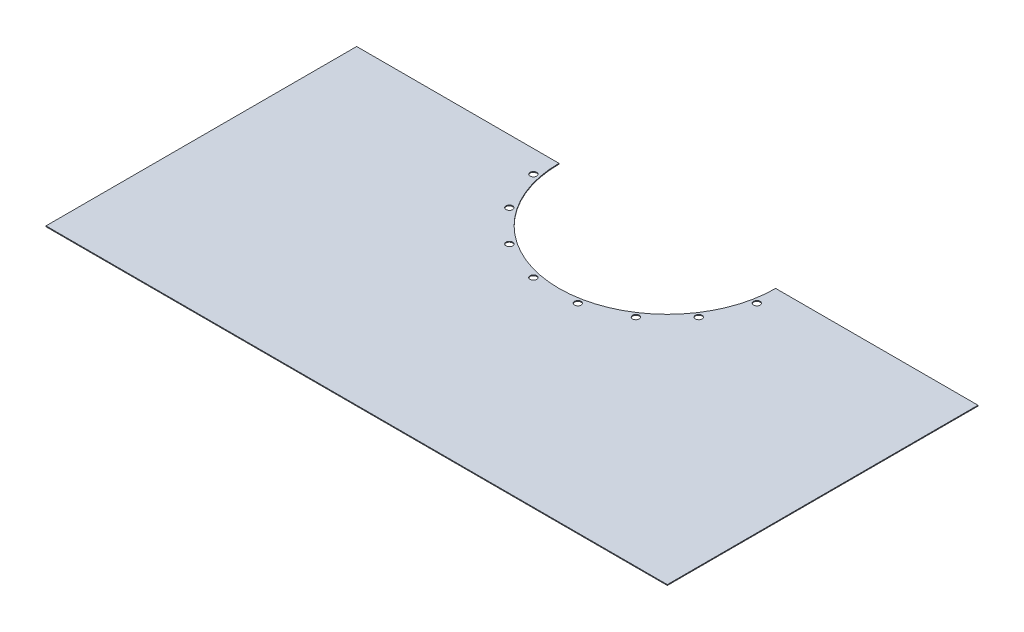
from build123d import *

# Parameters (mm, degrees)
SKETCH2_R           = 6.5
BOSS_EXTRUDE2_DEPTH = 1.5875


with BuildPart() as part:
    # Sketch2 → Boss-Extrude2 (new body)
    with BuildSketch(Plane(origin=(0, 0, 0), x_dir=(1, 0, 0), z_dir=(0, 1, 0))):
        with BuildLine():
            ThreePointArc((-212.625, 0), (0, -212.625), (212.625, 0))
            Line((212.625, 0), (609.6, 0))
            Line((609.6, 0), (609.6, -609.6))
            Line((609.6, -609.6), (-609.6, -609.6))
            Line((-609.6, -609.6), (-609.6, 0))
            Line((-609.6, 0), (-212.625, 0))
        make_face()
        with Locations(Location((-219.20551017, -43.602686971, 0), (0, 0, 270))):
            Circle(SKETCH2_R, mode=Mode.SUBTRACT)
        with Locations(Location((-185.83345835, -124.16994708, 0), (0, 0, 270))):
            Circle(SKETCH2_R, mode=Mode.SUBTRACT)
        with Locations(Location((-124.16994708, -185.83345835, 0), (0, 0, 270))):
            Circle(SKETCH2_R, mode=Mode.SUBTRACT)
        with Locations(Location((-43.602686971, -219.20551017, 0), (0, 0, 270))):
            Circle(SKETCH2_R, mode=Mode.SUBTRACT)
        with Locations(Location((43.602686971, -219.20551017, 0), (0, 0, 270))):
            Circle(SKETCH2_R, mode=Mode.SUBTRACT)
        with Locations(Location((124.16994708, -185.83345835, 0), (0, 0, 270))):
            Circle(SKETCH2_R, mode=Mode.SUBTRACT)
        with Locations(Location((185.83345835, -124.16994708, 0), (0, 0, 270))):
            Circle(SKETCH2_R, mode=Mode.SUBTRACT)
        with Locations(Location((219.20551017, -43.602686971, 0), (0, 0, 270))):
            Circle(SKETCH2_R, mode=Mode.SUBTRACT)
    extrude(amount=BOSS_EXTRUDE2_DEPTH)


solid = part.part
